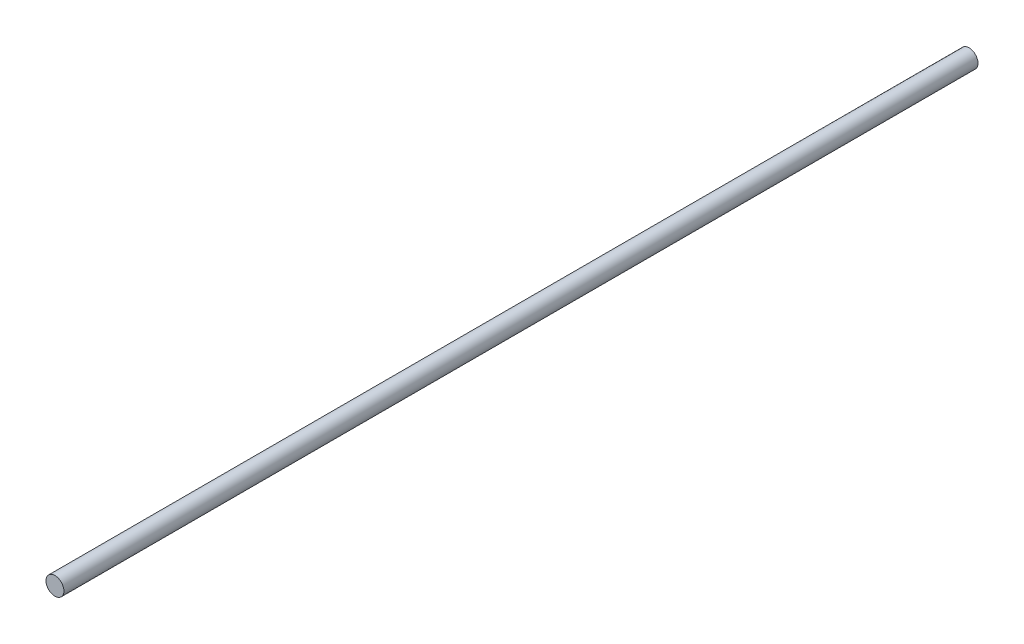
from build123d import *

# Parameters (mm, degrees)
SKETCH1_R           = 5
BOSS_EXTRUDE1_DEPTH = 510


with BuildPart() as part:
    # Sketch1 → Boss-Extrude1 (new body)
    with BuildSketch(Plane.XY):
        Circle(SKETCH1_R)
    extrude(amount=BOSS_EXTRUDE1_DEPTH)


solid = part.part
